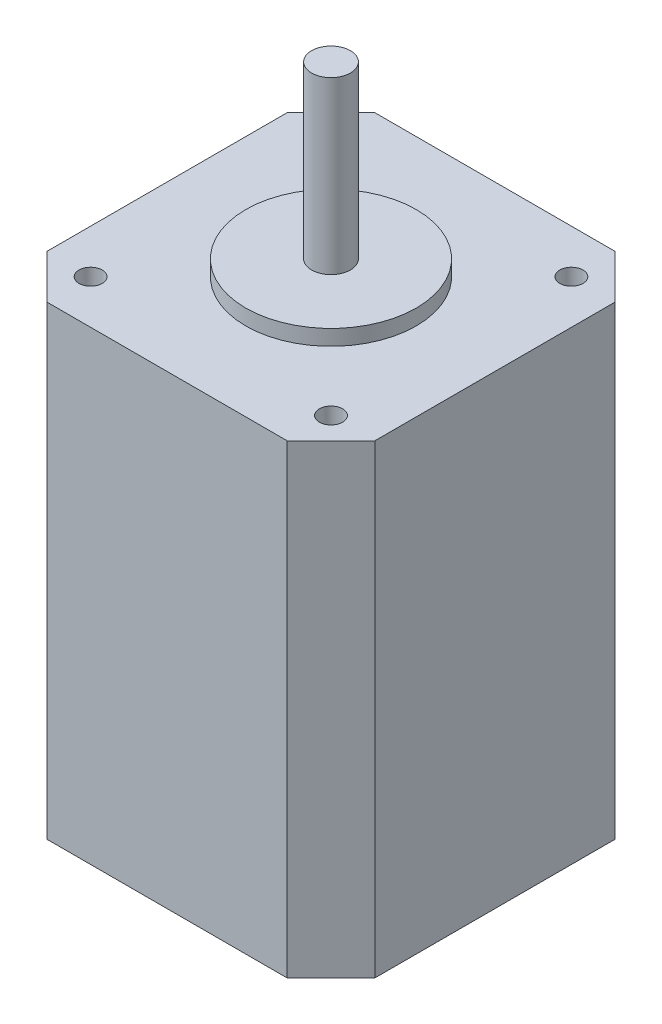
from build123d import *

# Parameters (mm, degrees)
SKETCH_1_R      = 1.5
EXTRUDE_1_DEPTH = 60
SKETCH_2_R      = 11
EXTRUDE_2_DEPTH = 2
SKETCH_3_R      = 2.5
EXTRUDE_3_DEPTH = 22


with BuildPart() as part:
    # 草圖1 → 填料-伸長1 (new body)
    with BuildSketch(Plane(origin=(0, 0, 0), x_dir=(1, 0, 0), z_dir=(0, 1, 0))):
        Polygon((-15.5, 21.15), (15.5, 21.15), (21.15, 15.5), (21.15, -15.5), (15.5, -21.15), (-15.5, -21.15), (-21.15, -15.5), (-21.15, 15.5), align=None)
        with Locations(Location((-15.5, 15.5, 0), (0, 0, 90))):
            Circle(SKETCH_1_R, mode=Mode.SUBTRACT)
        with Locations(Location((15.5, 15.5, 0), (0, 0, 90))):
            Circle(SKETCH_1_R, mode=Mode.SUBTRACT)
        with Locations(Location((15.5, -15.5, 0), (0, 0, 90))):
            Circle(SKETCH_1_R, mode=Mode.SUBTRACT)
        with Locations(Location((-15.5, -15.5, 0), (0, 0, 90))):
            Circle(SKETCH_1_R, mode=Mode.SUBTRACT)
    extrude(amount=EXTRUDE_1_DEPTH)

    # 草圖2 → 填料-伸長2 (add)
    with BuildSketch(Plane(origin=(0, 60, 0), x_dir=(1, 0, 0), z_dir=(0, 1, 0))):
        with Locations(Location((0, 0, 0), (0, 0, 90))):
            Circle(SKETCH_2_R)
    extrude(amount=EXTRUDE_2_DEPTH)

    # 草圖3 → 填料-伸長3 (add)
    with BuildSketch(Plane(origin=(0, 62, 0), x_dir=(1, 0, 0), z_dir=(0, 1, 0))):
        with Locations(Location((0, 0, 0), (0, 0, 270))):
            Circle(SKETCH_3_R)
    extrude(amount=EXTRUDE_3_DEPTH)


solid = part.part
